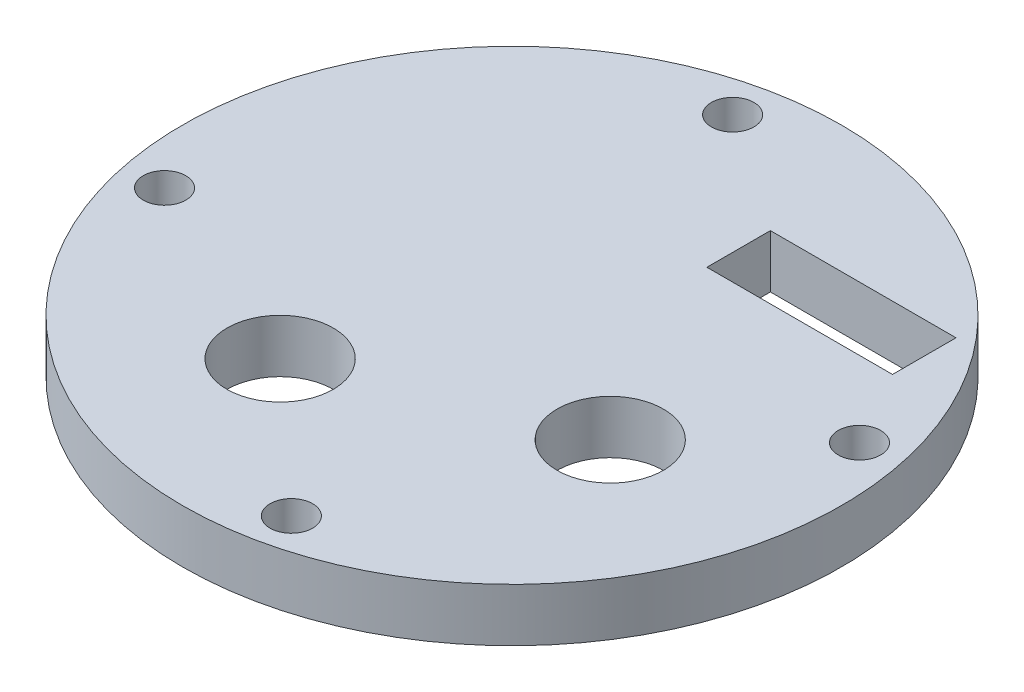
from build123d import *

# Parameters (mm, degrees)
SKETCH1_R           = 31
BOSS_EXTRUDE1_DEPTH = 5
SKETCH2_R           = 2
CUT_EXTRUDE1_DEPTH  = 12.5
SKETCH5_W           = 17.462022727
SKETCH5_H           = 5.971364383
CUT_EXTRUDE3_DEPTH  = 5
SKETCH6_R           = 5
CUT_EXTRUDE4_DEPTH  = 5


with BuildPart() as part:
    # Sketch1 → Boss-Extrude1 (new body)
    with BuildSketch(Plane(origin=(0, 0, 0), x_dir=(1, 0, 0), z_dir=(0, 1, 0))):
        with Locations(Location((0, 0, 0), (0, 0, 270))):
            Circle(SKETCH1_R)
    extrude(amount=BOSS_EXTRUDE1_DEPTH)

    # Sketch2 → Cut-Extrude1 (cut)
    with BuildSketch(Plane(origin=(0, 5, 0), x_dir=(1, 0, 0), z_dir=(0, 1, 0))):
        with Locations(Location((-26.719955328, -5.965376271, 0), (0, 0, 270))):
            Circle(SKETCH2_R)
        with Locations(Location((-5.965376271, 26.719955328, 0), (0, 0, 270))):
            Circle(SKETCH2_R)
        with Locations(Location((26.719955328, 5.965376271, 0), (0, 0, 270))):
            Circle(SKETCH2_R)
        with Locations(Location((5.965376271, -26.719955328, 0), (0, 0, 270))):
            Circle(SKETCH2_R)
    extrude(amount=-CUT_EXTRUDE1_DEPTH, mode=Mode.SUBTRACT)

    # Sketch5 → Cut-Extrude3 (cut)
    with BuildSketch(Plane(origin=(0, 5, 0), x_dir=(1, 0, 0), z_dir=(0, 1, 0))):
        with Locations((13.983311231, 16.066566387)):
            Rectangle(SKETCH5_W, SKETCH5_H)
    extrude(amount=-CUT_EXTRUDE3_DEPTH, mode=Mode.SUBTRACT)

    # Sketch6 → Cut-Extrude4 (cut)
    with BuildSketch(Plane(origin=(0, 5, 0), x_dir=(1, 0, 0), z_dir=(0, 1, 0))):
        with Locations(Location((-7.372449441, -14.438403546, 0), (0, 0, 270))):
            Circle(SKETCH6_R)
        with Locations(Location((14.753523974, -5.51293548, 0), (0, 0, 270))):
            Circle(SKETCH6_R)
    extrude(amount=-CUT_EXTRUDE4_DEPTH, mode=Mode.SUBTRACT)


solid = part.part
